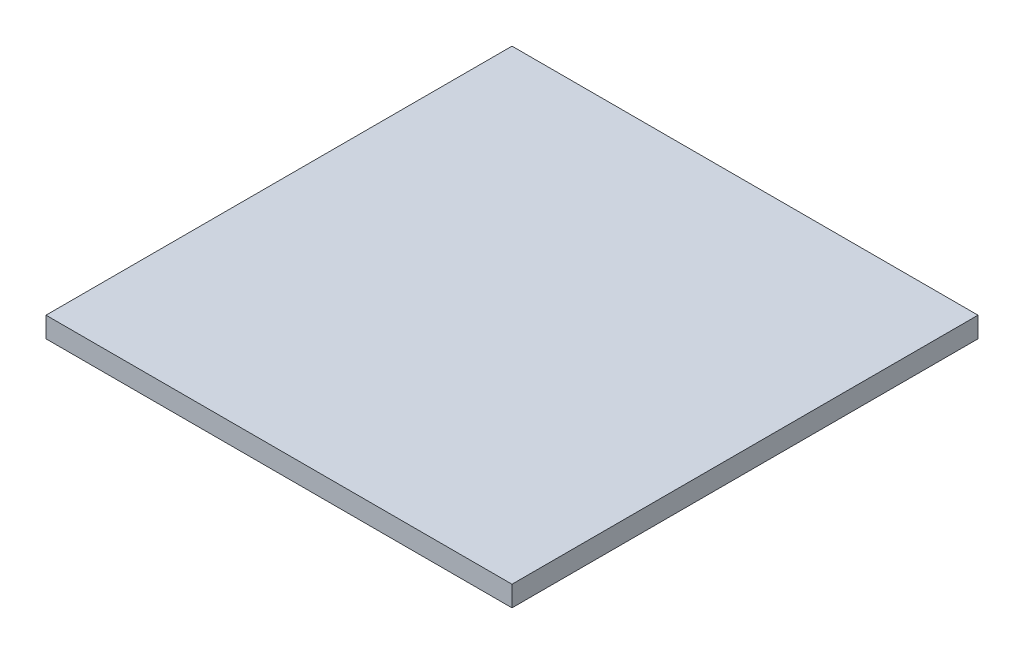
from build123d import *

# Parameters (mm, degrees)
SKETCH_1_W      = 25
SKETCH_1_H      = 25
EXTRUDE_1_DEPTH = 1.1


with BuildPart() as part:
    # 草图1 → 凸台-拉伸1 (new body)
    with BuildSketch(Plane(origin=(0, 0, 0), x_dir=(1, 0, 0), z_dir=(0, 1, 0))):
        with Locations((12.5, 12.5)):
            Rectangle(SKETCH_1_W, SKETCH_1_H)
    extrude(amount=EXTRUDE_1_DEPTH)


solid = part.part
